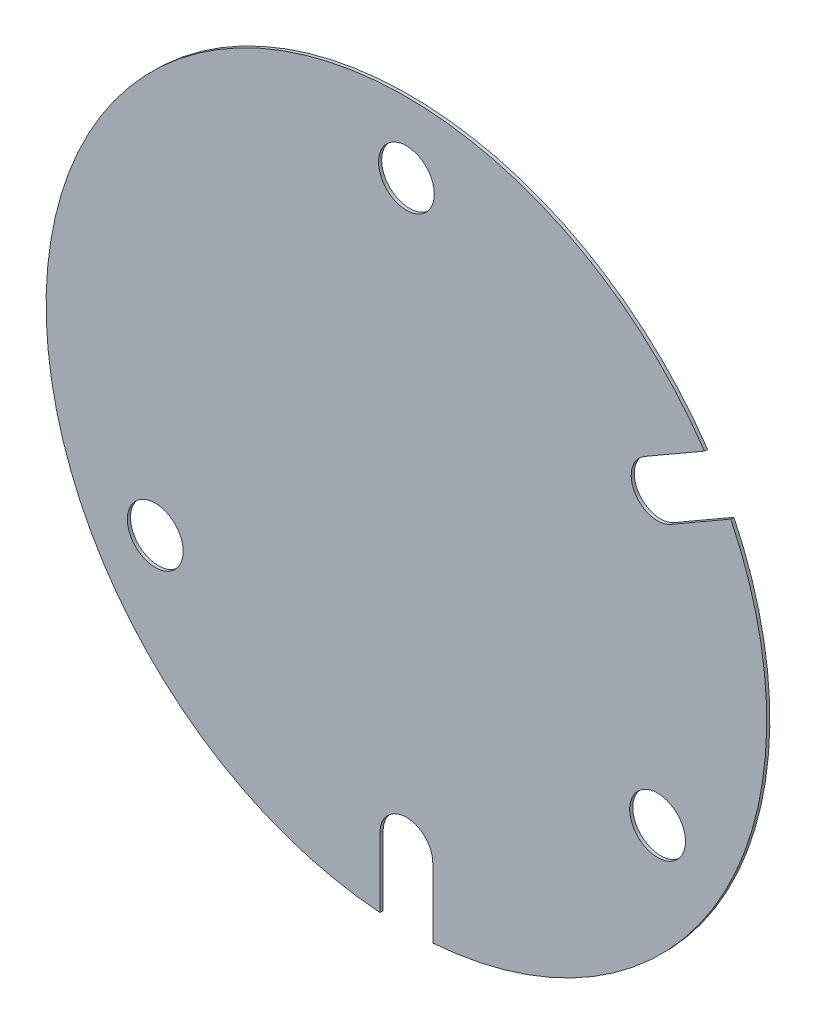
from build123d import *

# Parameters (mm, degrees)
SKETCH3_R          = 20.5
SKETCH3_R_2        = 1.5875
EXTRUDE2_DEPTH     = 0.1778
SKETCH5_R          = 1.5
CUT_EXTRUDE1_DEPTH = 29.991923235
CIRPATTERN1_COUNT  = 3


with BuildPart() as part:
    # Sketch3 → Extrude2 (new body)
    with BuildSketch(Plane.XY):
        Circle(SKETCH3_R)
        with Locations((0, 16.5)):
            Circle(SKETCH3_R_2, mode=Mode.SUBTRACT)
        with Locations((14.289419162, -8.25)):
            Circle(SKETCH3_R_2, mode=Mode.SUBTRACT)
        with Locations((-14.289419162, -8.25)):
            Circle(SKETCH3_R_2, mode=Mode.SUBTRACT)
    extrude(amount=EXTRUDE2_DEPTH)

    # Sketch5 → Cut-Extrude1 (cut, through all)
    with BuildSketch(Plane.XY):
        with BuildLine():
            Line((1.5, -20.4450483), (1.5, -16.5))
            ThreePointArc((1.5, -16.5), (0, -18), (-1.5, -16.5))
            Line((-1.5, -16.5), (-1.5, -20.4450483))
            ThreePointArc((-1.5, -20.4450483), (0, -20.5), (1.5, -20.4450483))
        make_face()
        with Locations((0, -16.5)):
            Circle(SKETCH5_R)
    cut_extrude1 = extrude(amount=CUT_EXTRUDE1_DEPTH, mode=Mode.SUBTRACT)

    # CirPattern1: Cut-Extrude1 ×3 about axis, 1 skipped
    cirpattern1_axis = Axis((0, 0, 0.1778), (0, 0, -1))
    add([cut_extrude1.rotate(cirpattern1_axis, i * 360 / CIRPATTERN1_COUNT) for i in range(1, CIRPATTERN1_COUNT) if i not in (1,)], mode=Mode.SUBTRACT)


solid = part.part
